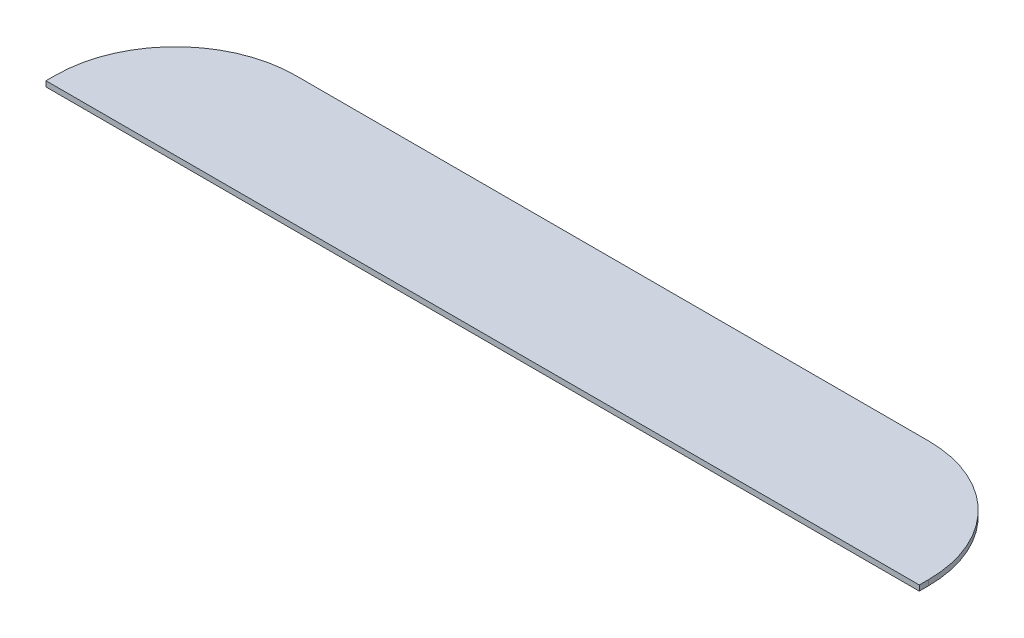
from build123d import *

# Parameters (mm, degrees)
BOSS_EXTRUDE1_DEPTH = 3.175


with BuildPart() as part:
    # Sketch1 → Boss-Extrude1 (new body)
    with BuildSketch(Plane(origin=(0, 0, 0), x_dir=(1, 0, 0), z_dir=(0, 1, 0))):
        with BuildLine():
            Line((-257.175, 0), (257.175, 0))
            Line((257.175, 0), (257.175, 5.4))
            ThreePointArc((257.175, 5.4), (236.438160108, 55.463160108), (186.375, 76.2))
            Line((186.375, 76.2), (-186.375, 76.2))
            ThreePointArc((-186.375, 76.2), (-236.438160108, 55.463160108), (-257.175, 5.4))
            Line((-257.175, 5.4), (-257.175, 0))
        make_face()
    extrude(amount=BOSS_EXTRUDE1_DEPTH)


solid = part.part
